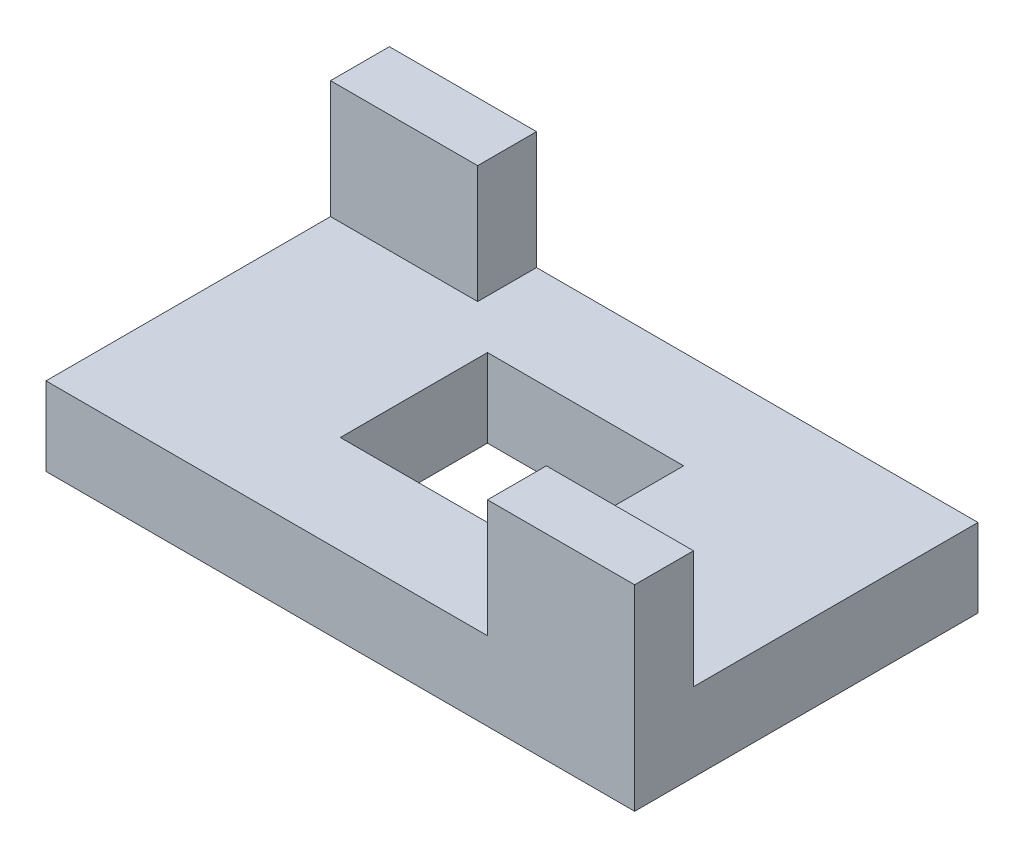
from build123d import *

# Parameters (mm, degrees)
SKETCH1_W           = 60
SKETCH1_H           = 35
BOSS_EXTRUDE1_DEPTH = 8
SKETCH2_W           = 15
SKETCH2_H           = 6
BOSS_EXTRUDE2_DEPTH = 20
SKETCH3_W           = 20
SKETCH3_H           = 15
CUT_EXTRUDE2_DEPTH  = 41.078048855


with BuildPart() as part:
    # Sketch1 → Boss-Extrude1 (new body)
    with BuildSketch(Plane(origin=(0, 0, 0), x_dir=(1, 0, 0), z_dir=(0, 1, 0))):
        Rectangle(SKETCH1_W, SKETCH1_H)
    extrude(amount=BOSS_EXTRUDE1_DEPTH)

    # Sketch2 → Boss-Extrude2 (add)
    with BuildSketch(Plane(origin=(0, 0, 0), x_dir=(1, 0, 0), z_dir=(0, 1, 0))):
        with Locations((-22.5, 14.5)):
            Rectangle(SKETCH2_W, SKETCH2_H)
        with Locations((22.5, -14.5)):
            Rectangle(SKETCH2_W, SKETCH2_H)
    extrude(amount=BOSS_EXTRUDE2_DEPTH)

    # Sketch3 → Cut-Extrude2 (cut, through all)
    with BuildSketch(Plane(origin=(0, 0, 0), x_dir=(1, 0, 0), z_dir=(0, 1, 0))):
        Rectangle(SKETCH3_W, SKETCH3_H)
    extrude(amount=CUT_EXTRUDE2_DEPTH, mode=Mode.SUBTRACT)


solid = part.part
